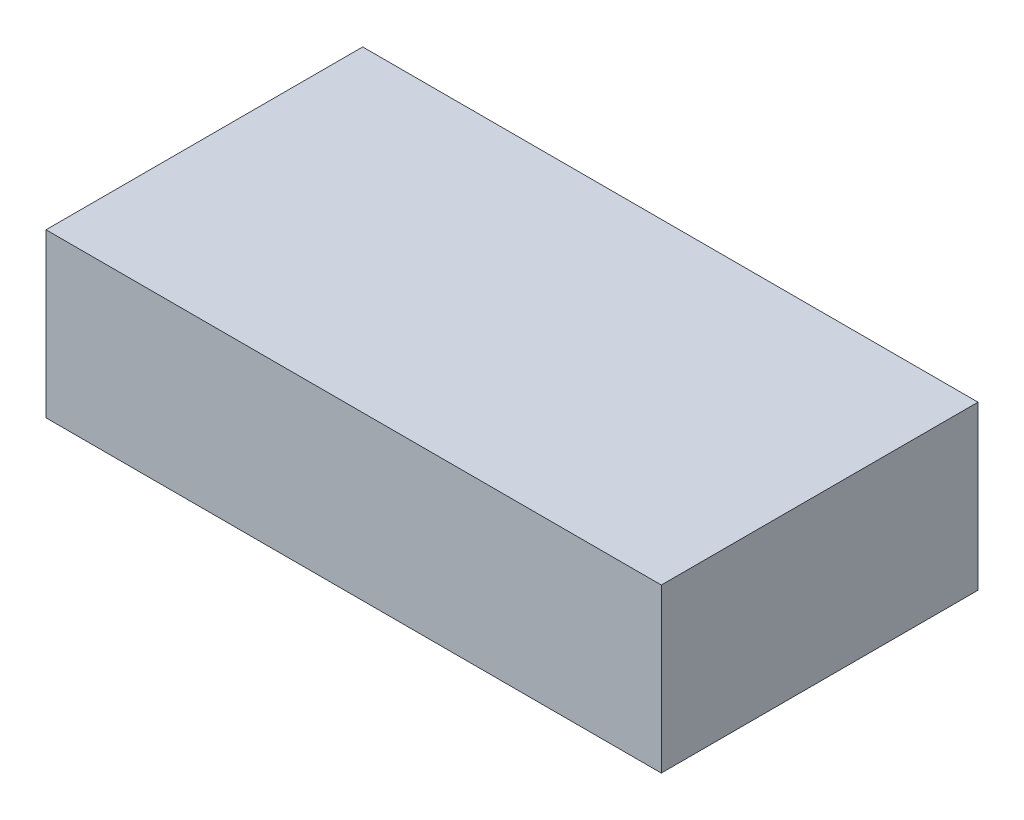
from build123d import *

# Parameters (mm, degrees)
SKETCH1_W           = 68
SKETCH1_H           = 35
BOSS_EXTRUDE1_DEPTH = 18


with BuildPart() as part:
    # Sketch1 → Boss-Extrude1 (new body)
    with BuildSketch(Plane(origin=(0, 0, 0), x_dir=(1, 0, 0), z_dir=(0, 1, 0))):
        Rectangle(SKETCH1_W, SKETCH1_H)
    extrude(amount=BOSS_EXTRUDE1_DEPTH)


solid = part.part
